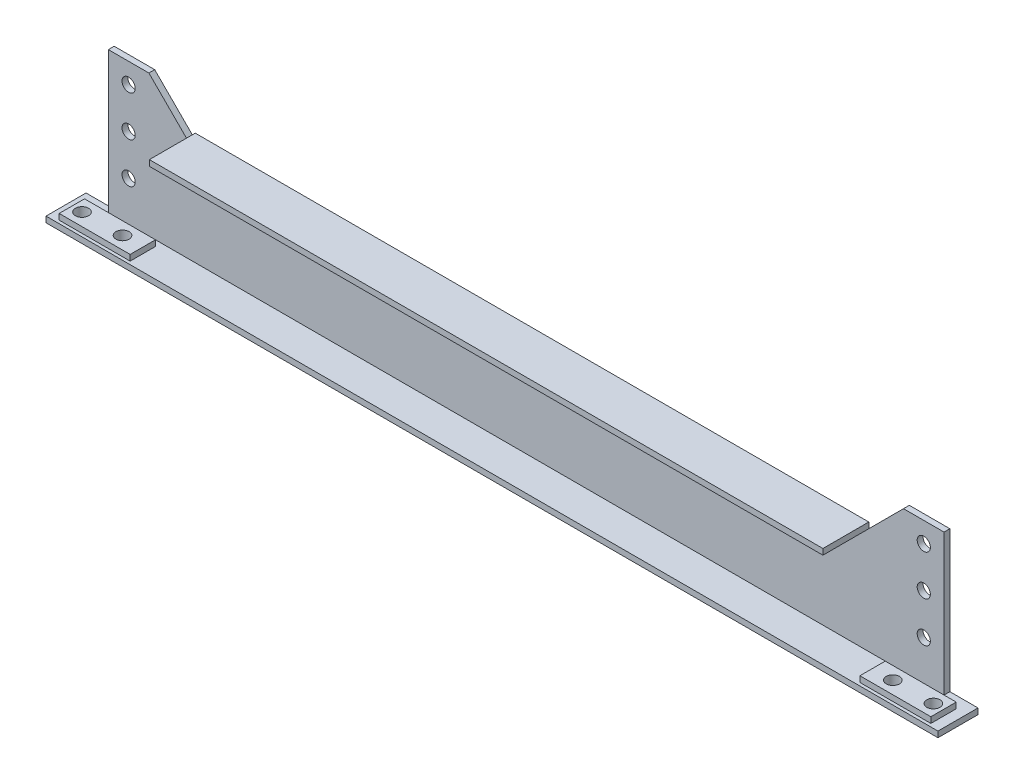
from build123d import *

# Parameters (mm, degrees)
SKETCH_1_R           = 13
EXTRUDE_660_DEPTH    = 11.5
EXTRUDE_7_DEPTH      = 79
EXTRUDE_7_DEPTH_BACK = 11.5
SKETCH_2_W           = 1329
SKETCH_2_H           = 11.5
EXTRUDE_9_DEPTH      = 67.5
EXTRUDE_9_DEPTH_BACK = 11.5
SKETCH_3_W           = 1760
SKETCH_3_H           = 11.5
SKETCH_4_W           = 140
SKETCH_4_H           = 50
EXTRUDE_10_DEPTH     = 11.5
SKETCH_6_R           = 13
CUT_EXTRUDE_1_DEPTH  = 931.962002447


with BuildPart() as part:
    # 草图1 → Extrude 660 (new body)
    with BuildSketch(Plane.XY):
        Polygon((-744.5, 139.25), (-664.5, 59.25), (664.5, 59.25), (744.5, 139.25), (824.5, 139.25), (824.5, -139.25), (-824.5, -139.25), (-824.5, 139.25), align=None)
        with Locations((-784.5, 99.25)):
            Circle(SKETCH_1_R, mode=Mode.SUBTRACT)
        with Locations((-784.5, 19.25)):
            Circle(SKETCH_1_R, mode=Mode.SUBTRACT)
        with Locations((-784.5, -60.75)):
            Circle(SKETCH_1_R, mode=Mode.SUBTRACT)
        with Locations(Location((784.5, -60.75, 0), (0, 0, 180))):
            Circle(SKETCH_1_R, mode=Mode.SUBTRACT)
        with Locations(Location((784.5, 19.25, 0), (0, 0, 180))):
            Circle(SKETCH_1_R, mode=Mode.SUBTRACT)
        with Locations(Location((784.5, 99.25, 0), (0, 0, 180))):
            Circle(SKETCH_1_R, mode=Mode.SUBTRACT)
    extrude(amount=EXTRUDE_660_DEPTH)

    # 草图2 → 凸台-拉伸7 (add, two sides: drawn at the far end of the back side and taken through both)
    with BuildSketch(Plane.XY.offset(11.5).offset(-EXTRUDE_7_DEPTH_BACK)):
        with Locations((0, 65)):
            Rectangle(SKETCH_2_W, SKETCH_2_H)
    extrude(amount=EXTRUDE_7_DEPTH + EXTRUDE_7_DEPTH_BACK)

    # 草图3 → 凸台-拉伸9 (add, two sides: drawn at the far end of the back side and taken through both)
    with BuildSketch(Plane.XY.offset(11.5).offset(-EXTRUDE_9_DEPTH_BACK)):
        with Locations((0, -145)):
            Rectangle(SKETCH_3_W, SKETCH_3_H)
    extrude(amount=EXTRUDE_9_DEPTH + EXTRUDE_9_DEPTH_BACK)

    # 草图4 → 凸台-拉伸10 (add)
    with BuildSketch(Plane(origin=(0, -139.25, 0), x_dir=(-1, 0, 0), z_dir=(0, 1, 0))):
        with Locations((-790, 48)):
            Rectangle(SKETCH_4_W, SKETCH_4_H)
        with Locations((790, 48)):
            Rectangle(SKETCH_4_W, SKETCH_4_H)
    extrude(amount=EXTRUDE_10_DEPTH)

    # 草图6 → 切除-拉伸1 (cut, through all)
    with BuildSketch(Plane.XZ.offset(150.75)):
        with Locations((-840, 48)):
            Circle(SKETCH_6_R)
        with Locations((-760, 48)):
            Circle(SKETCH_6_R)
        with Locations(Location((760, 48, 0), (0, 0, 180))):
            Circle(SKETCH_6_R)
        with Locations(Location((840, 48, 0), (0, 0, 180))):
            Circle(SKETCH_6_R)
    extrude(amount=-CUT_EXTRUDE_1_DEPTH, mode=Mode.SUBTRACT)


solid = part.part
